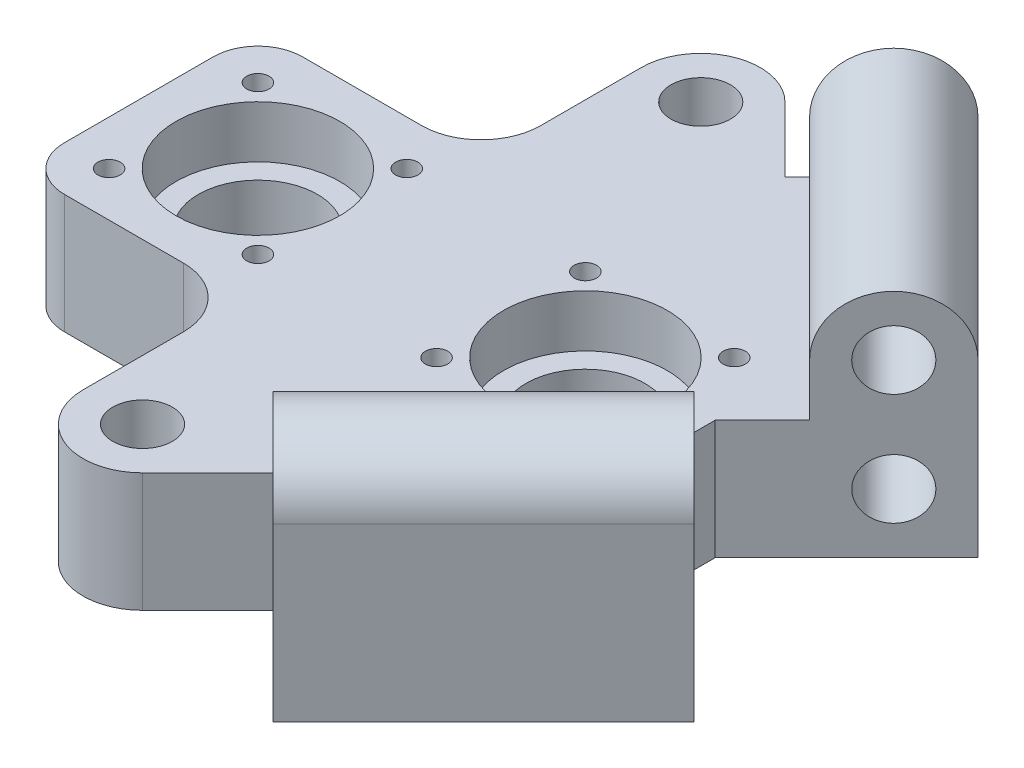
from build123d import *

# Parameters (mm, degrees)
SKETCH1_R           = 11
SKETCH1_R_2         = 1.5
SKETCH1_R_3         = 4
BOSS_EXTRUDE1_DEPTH = 16
SKETCH1_4_R         = 11
SKETCH1_4_R_2       = 8
BOSS_EXTRUDE2_DEPTH = 9
SKETCH2_R           = 4
CUT_EXTRUDE1_DEPTH  = 204.169017313
SKETCH3_R           = 4
CUT_EXTRUDE2_DEPTH  = 204.169017313
SKETCH1_5_R         = 11
SKETCH1_5_R_2       = 8
BOSS_EXTRUDE3_DEPTH = 9
CUT_EXTRUDE3_DEPTH  = 2.5
SKETCH5_R           = 4
BOSS_EXTRUDE4_DEPTH = 40
SKETCH6_R           = 4
BOSS_EXTRUDE5_DEPTH = 40


with BuildPart() as part:
    # Sketch1 → Boss-Extrude1 (new body)
    with BuildSketch(Plane(origin=(0, 0, 0), x_dir=(1, 0, 0), z_dir=(0, 1, 0))):
        with BuildLine():
            Line((196.404615305, 34.409093194), (187.656854249, 43.156854249))
            ThreePointArc((187.656854249, 43.156854249), (178.938532541, 44.89103626), (174, 37.5))
            Line((174, 37.5), (174, 24))
            ThreePointArc((174, 24), (171.656854249, 18.343145751), (166, 16))
            Line((166, 16), (150, 16))
            ThreePointArc((150, 16), (145.757359313, 14.242640687), (144, 10))
            Line((144, 10), (144, -10))
            ThreePointArc((144, -10), (145.757359313, -14.242640687), (150, -16))
            Line((150, -16), (166, -16))
            ThreePointArc((166, -16), (171.656854249, -18.343145751), (174, -24))
            Line((174, -24), (174, -37.5))
            ThreePointArc((174, -37.5), (178.938532541, -44.89103626), (187.656854249, -43.156854249))
            Line((187.656854249, -43.156854249), (196.404615305, -34.409093194))
            Line((196.404615305, -34.409093194), (209.37167645, -47.376154339))
            Line((209.37167645, -47.376154339), (237.655947698, -19.091883092))
            Line((237.655947698, -19.091883092), (220, -1.435935394))
            Line((220, -1.435935394), (220, 1.435935394))
            Line((220, 1.435935394), (237.655947698, 19.091883092))
            Line((237.655947698, 19.091883092), (209.37167645, 47.376154339))
            Line((209.37167645, 47.376154339), (196.404615305, 34.409093194))
        make_face()
        with Locations(Location((160, 0, 0), (0, 0, 270))):
            Circle(SKETCH1_R, mode=Mode.SUBTRACT)
        with Locations(Location((150, 10, 0), (0, 0, 270))):
            Circle(SKETCH1_R_2, mode=Mode.SUBTRACT)
        with Locations(Location((170, 10, 0), (0, 0, 270))):
            Circle(SKETCH1_R_2, mode=Mode.SUBTRACT)
        with Locations(Location((170, -10, 0), (0, 0, 270))):
            Circle(SKETCH1_R_2, mode=Mode.SUBTRACT)
        with Locations(Location((150, -10, 0), (0, 0, 270))):
            Circle(SKETCH1_R_2, mode=Mode.SUBTRACT)
        with Locations(Location((204, 0, 0), (0, 0, 270))):
            Circle(SKETCH1_R, mode=Mode.SUBTRACT)
        with Locations(Location((182, 37.5, 0), (0, 0, 270))):
            Circle(SKETCH1_R_3, mode=Mode.SUBTRACT)
        with Locations(Location((194, 10, 0), (0, 0, 270))):
            Circle(SKETCH1_R_2, mode=Mode.SUBTRACT)
        with Locations(Location((214, 10, 0), (0, 0, 270))):
            Circle(SKETCH1_R_2, mode=Mode.SUBTRACT)
        with Locations(Location((214, -10, 0), (0, 0, 270))):
            Circle(SKETCH1_R_2, mode=Mode.SUBTRACT)
        with Locations(Location((194, -10, 0), (0, 0, 270))):
            Circle(SKETCH1_R_2, mode=Mode.SUBTRACT)
        with Locations(Location((182, -37.5, 0), (0, 0, 270))):
            Circle(SKETCH1_R_3, mode=Mode.SUBTRACT)
    extrude(amount=BOSS_EXTRUDE1_DEPTH)

    # Sketch1<4> → Boss-Extrude2 (add)
    with BuildSketch(Plane(origin=(0, 0, 0), x_dir=(1, 0, 0), z_dir=(0, 1, 0))):
        with Locations(Location((204, 0, 0), (0, 0, 270))):
            Circle(SKETCH1_4_R)
        with Locations(Location((204, 0, 0), (0, 0, 270))):
            Circle(SKETCH1_4_R_2, mode=Mode.SUBTRACT)
    extrude(amount=BOSS_EXTRUDE2_DEPTH)

    # Sketch2 → Cut-Extrude1 (cut, through all)
    with BuildSketch(Plane(origin=(109.282032303, 0, 109.282032303), x_dir=(0.7071067811865286, 0, -0.7071067811865666), z_dir=(0.7071067811865666, 0, 0.7071067811865286))):
        with Locations((173.548132206, 8)):
            Circle(SKETCH2_R)
    extrude(amount=-CUT_EXTRUDE1_DEPTH, mode=Mode.SUBTRACT)

    # Sketch3 → Cut-Extrude2 (cut, through all)
    with BuildSketch(Plane(origin=(109.282032303, 0, -109.282032303), x_dir=(-0.7071067811865511, 0, -0.707106781186544), z_dir=(0.707106781186544, 0, -0.7071067811865511))):
        with Locations((-173.548132206, 8)):
            Circle(SKETCH3_R)
    extrude(amount=-CUT_EXTRUDE2_DEPTH, mode=Mode.SUBTRACT)

    # Sketch1<5> → Boss-Extrude3 (add)
    with BuildSketch(Plane(origin=(0, 0, 0), x_dir=(1, 0, 0), z_dir=(0, 1, 0))):
        with Locations(Location((160, 0, 0), (0, 0, 270))):
            Circle(SKETCH1_5_R)
        with Locations(Location((160, 0, 0), (0, 0, 270))):
            Circle(SKETCH1_5_R_2, mode=Mode.SUBTRACT)
    extrude(amount=BOSS_EXTRUDE3_DEPTH)

    # Sketch4 → Cut-Extrude3 (cut)
    with BuildSketch(Plane.XZ):
        Polygon((153.464101615, 10), (151.732050808, 13), (148.267949192, 13), (146.535898385, 10), (148.267949192, 7), (151.732050808, 7), align=None)
        Polygon((173.464101615, 10), (171.732050808, 13), (168.267949192, 13), (166.535898385, 10), (168.267949192, 7), (171.732050808, 7), align=None)
        Polygon((153.464101615, -10), (151.732050808, -7), (148.267949192, -7), (146.535898385, -10), (148.267949192, -13), (151.732050808, -13), align=None)
        Polygon((173.464101615, -10), (171.732050808, -7), (168.267949192, -7), (166.535898385, -10), (168.267949192, -13), (171.732050808, -13), align=None)
        Polygon((197.464101615, 10), (195.732050808, 13), (192.267949192, 13), (190.535898385, 10), (192.267949192, 7), (195.732050808, 7), align=None)
        Polygon((217.464101615, 10), (215.732050808, 13), (212.267949192, 13), (210.535898385, 10), (212.267949192, 7), (215.732050808, 7), align=None)
        Polygon((197.464101615, -10), (195.732050808, -7), (192.267949192, -7), (190.535898385, -10), (192.267949192, -13), (195.732050808, -13), align=None)
        Polygon((217.464101615, -10), (215.732050808, -7), (212.267949192, -7), (210.535898385, -10), (212.267949192, -13), (215.732050808, -13), align=None)
    extrude(amount=-CUT_EXTRUDE3_DEPTH, mode=Mode.SUBTRACT)

    # Sketch5 → Boss-Extrude4 (add)
    with BuildSketch(Plane(origin=(80.997761055, 0, -80.997761055), x_dir=(0.7071067811865509, 0, 0.7071067811865441), z_dir=(-0.7071067811865441, 0, 0.7071067811865509))):
        with BuildLine():
            Line((181.548132206, 16), (181.548132206, 23))
            ThreePointArc((181.548132206, 23), (173.548132206, 31), (165.548132206, 23))
            Line((165.548132206, 23), (165.548132206, 16))
            Line((165.548132206, 16), (181.548132206, 16))
        make_face()
        with Locations((173.548132206, 23)):
            Circle(SKETCH5_R, mode=Mode.SUBTRACT)
    extrude(amount=-BOSS_EXTRUDE4_DEPTH)

    # Sketch6 → Boss-Extrude5 (add)
    with BuildSketch(Plane(origin=(80.997761055, 0, 80.997761055), x_dir=(-0.7071067811865172, 0, 0.707106781186578), z_dir=(-0.707106781186578, 0, -0.7071067811865172))):
        with BuildLine():
            Line((-165.548132206, 16), (-165.548132206, 23))
            ThreePointArc((-165.548132206, 23), (-173.548132206, 31), (-181.548132206, 23))
            Line((-181.548132206, 23), (-181.548132206, 16))
            Line((-181.548132206, 16), (-165.548132206, 16))
        make_face()
        with Locations((-173.548132206, 23)):
            Circle(SKETCH6_R, mode=Mode.SUBTRACT)
    extrude(amount=-BOSS_EXTRUDE5_DEPTH)


solid = part.part
